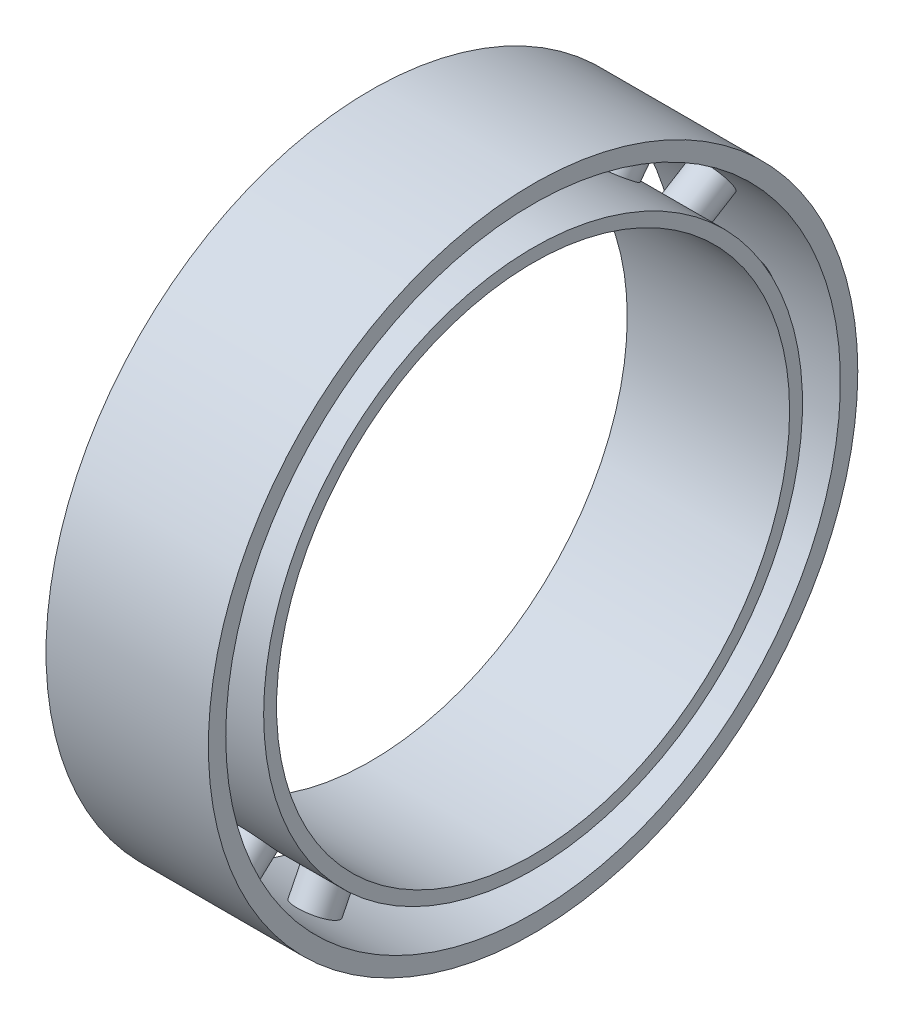
from build123d import *

# Parameters (mm, degrees)
SKETCH1_R           = 25.4
SKETCH1_R_2         = 20.066
BOSS_EXTRUDE1_DEPTH = 12.7
SKETCH2_R           = 24.040986305
SKETCH2_R_2         = 21.076682246
CUT_EXTRUDE1_DEPTH  = 12.7
SKETCH5_R           = 1.5875
BOSS_EXTRUDE5_DEPTH = 4.064
CIRPATTERN4_COUNT   = 17


with BuildPart() as part:
    # Sketch1 → Boss-Extrude1 (new body)
    with BuildSketch(Plane(origin=(0, 0, 0), x_dir=(0, 0, -1), z_dir=(1, 0, 0))):
        Circle(SKETCH1_R)
        Circle(SKETCH1_R_2, mode=Mode.SUBTRACT)
    extrude(amount=BOSS_EXTRUDE1_DEPTH)

    # Sketch2 → Cut-Extrude1 (cut)
    with BuildSketch(Plane.ZY):
        Circle(SKETCH2_R)
        Circle(SKETCH2_R_2, mode=Mode.SUBTRACT)
    extrude(amount=-CUT_EXTRUDE1_DEPTH, mode=Mode.SUBTRACT)


with BuildPart() as cut_extrude1_piece_1:
    # of the separate pieces the step leaves, piece 1, a body of its own (cut_extrude1_pieces)
    add(part.part.solids().sort_by_distance((0, 0, -25.4))[0])



with BuildPart() as cut_extrude1_piece_2:
    # of the separate pieces the step leaves, piece 2, a body of its own (cut_extrude1_pieces)
    add(part.part.solids().sort_by_distance((0, 0, 21.076682246))[0])


with BuildPart() as cut_extrude1_piece_1_1:
    add(cut_extrude1_piece_1.part)

    add(cut_extrude1_piece_2.part)  # Boss-Extrude5 merges Cut-Extrude1 piece 2
    # Sketch5 → Boss-Extrude5 (add)
    with BuildSketch(Plane.XY.offset(20.628435951)):
        with Locations(Location((6.35, 0, 0), (0, 0, 180))):
            Circle(SKETCH5_R)
    boss_extrude5 = extrude(amount=BOSS_EXTRUDE5_DEPTH)

    # CirPattern4: Boss-Extrude5 ×17 about axis
    cirpattern4_axis = Axis((12.7, 0, 0), (-1, 0, 0))
    for i in range(1, CIRPATTERN4_COUNT):
        add(boss_extrude5.rotate(cirpattern4_axis, i * 360 / CIRPATTERN4_COUNT))


solid = cut_extrude1_piece_1_1.part
